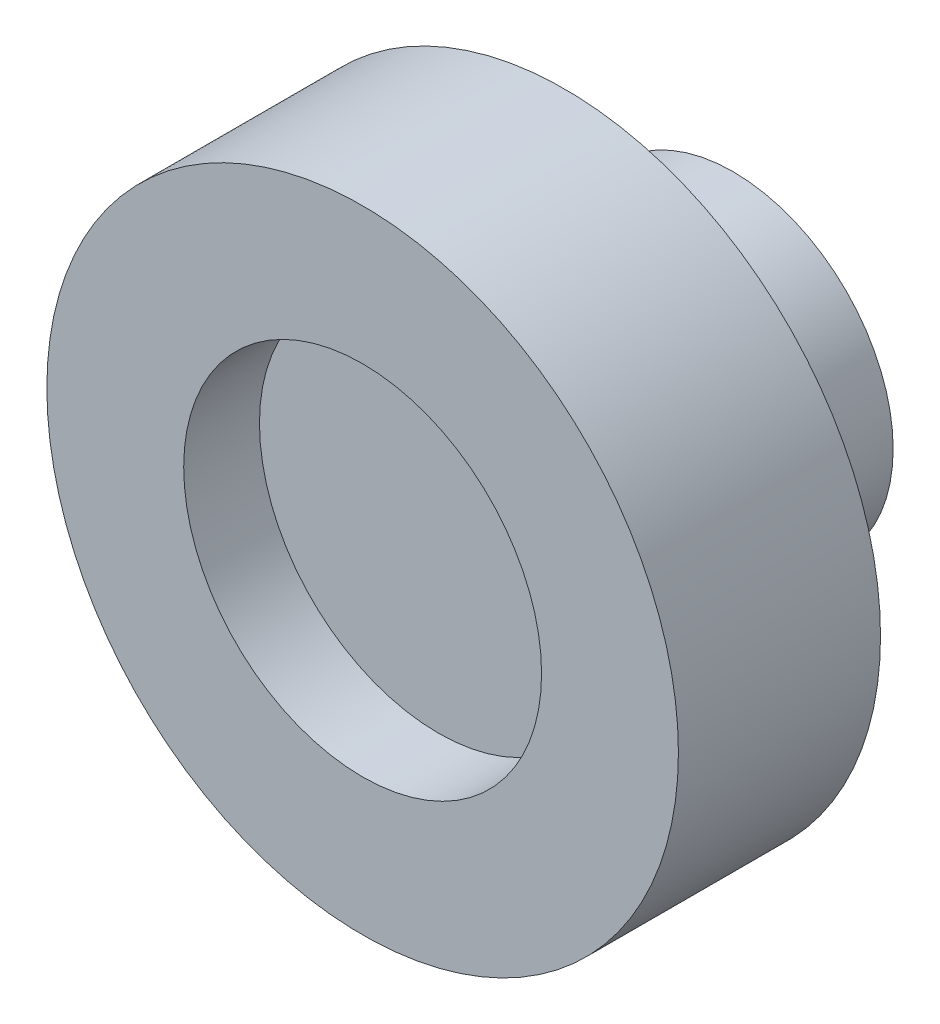
from build123d import *

# Parameters (mm, degrees)
SZKIC1_R                    = 7.5
DODANIE_WYCI_GNI_CIE1_DEPTH = 3
SZKIC2_R                    = 3.8
DODANIE_WYCI_GNI_CIE2_DEPTH = 4
SZKIC3_R                    = 7.5
SZKIC3_R_2                  = 4.25
DODANIE_WYCI_GNI_CIE3_DEPTH = 1.8


with BuildPart() as part:
    # Szkic1 → Dodanie-wyciągnięcie1 (new body)
    with BuildSketch(Plane.XY):
        Circle(SZKIC1_R)
    extrude(amount=DODANIE_WYCI_GNI_CIE1_DEPTH)

    # Szkic2 → Dodanie-wyciągnięcie2 (add)
    with BuildSketch(Plane(origin=(0, 0, 0), x_dir=(-1, 0, 0), z_dir=(0, 0, -1))):
        Circle(SZKIC2_R)
    extrude(amount=DODANIE_WYCI_GNI_CIE2_DEPTH)

    # Szkic3 → Dodanie-wyciągnięcie3 (add)
    with BuildSketch(Plane.XY.offset(3)):
        Circle(SZKIC3_R)
        Circle(SZKIC3_R_2, mode=Mode.SUBTRACT)
    extrude(amount=DODANIE_WYCI_GNI_CIE3_DEPTH)


solid = part.part
